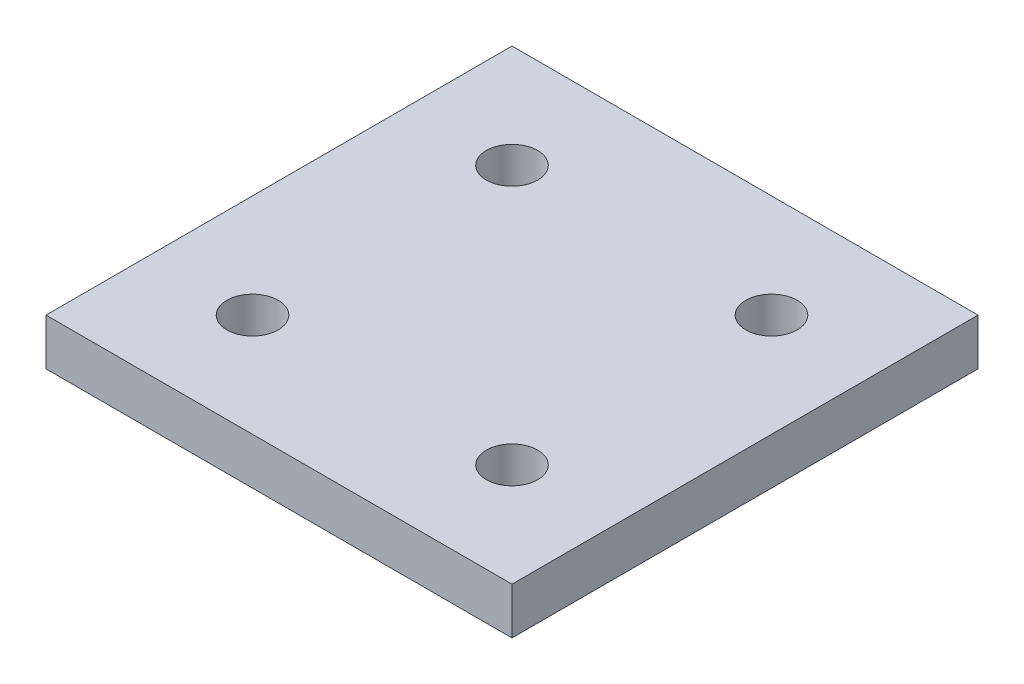
from build123d import *

# Parameters (mm, degrees)
SKETCH1_W           = 63.5
SKETCH1_H           = 63.5
BOSS_EXTRUDE1_DEPTH = 6.35
SKETCH2_R           = 3.5
CUT_EXTRUDE1_DEPTH  = 6.35


with BuildPart() as part:
    # Sketch1 → Boss-Extrude1 (new body)
    with BuildSketch(Plane(origin=(0, 0, 0), x_dir=(1, 0, 0), z_dir=(0, 1, 0))):
        Rectangle(SKETCH1_W, SKETCH1_H)
    extrude(amount=BOSS_EXTRUDE1_DEPTH)

    # Sketch2 → Cut-Extrude1 (cut)
    with BuildSketch(Plane(origin=(0, 6.35, 0), x_dir=(1, 0, 0), z_dir=(0, 1, 0))):
        with Locations(Location((-17.68, 17.68, 0), (0, 0, 270))):
            Circle(SKETCH2_R)
        with Locations(Location((17.68, 17.68, 0), (0, 0, 270))):
            Circle(SKETCH2_R)
        with Locations(Location((17.68, -17.68, 0), (0, 0, 270))):
            Circle(SKETCH2_R)
        with Locations(Location((-17.68, -17.68, 0), (0, 0, 270))):
            Circle(SKETCH2_R)
    extrude(amount=-CUT_EXTRUDE1_DEPTH, mode=Mode.SUBTRACT)


solid = part.part
